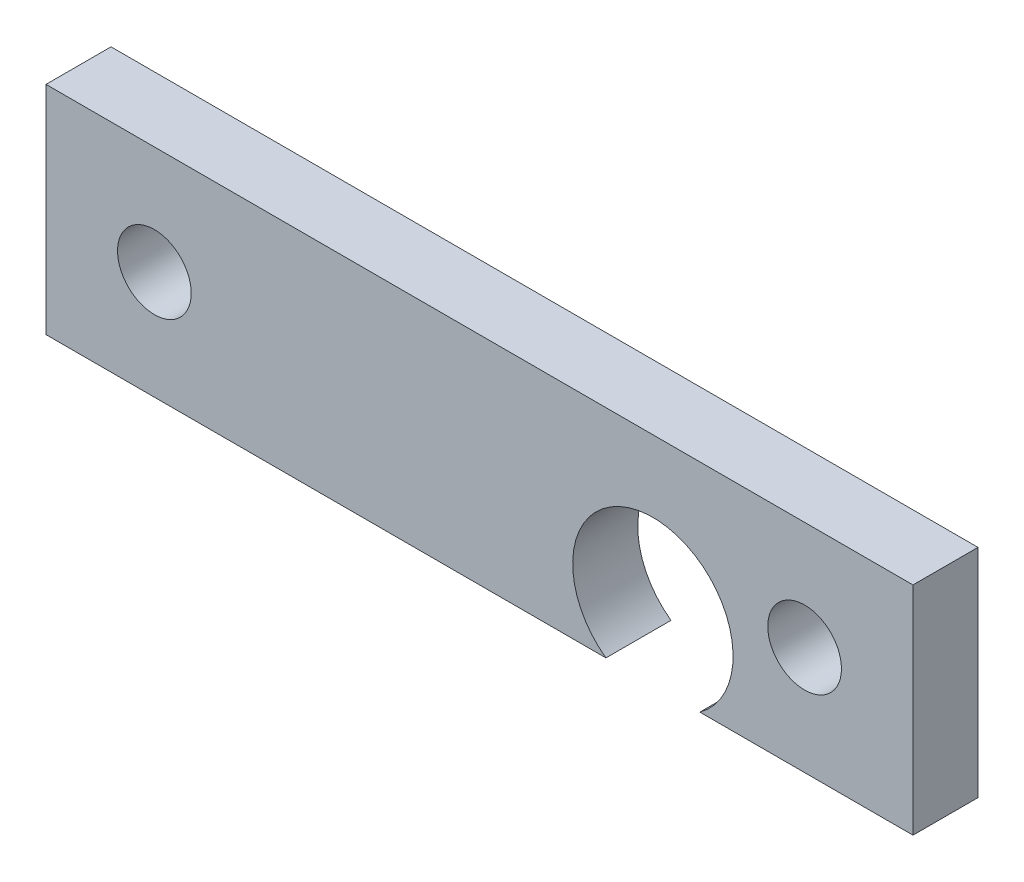
from build123d import *

# Parameters (mm, degrees)
MAIN_PROFILE_SKETCH_R = 1.7
MAIN_EXTRUSION_DEPTH  = 3


with BuildPart() as part:
    # Main Profile Sketch → Main Extrusion (new body)
    with BuildSketch(Plane.XY.offset(44.5)):
        with BuildLine():
            Line((-130, 41.5), (-90, 41.5))
            Line((-90, 41.5), (-90, 31.5))
            Line((-90, 31.5), (-99.834359217, 31.5))
            ThreePointArc((-99.834359217, 31.5), (-102, 38.2), (-104.165640783, 31.5))
            Line((-104.165640783, 31.5), (-130, 31.5))
            Line((-130, 31.5), (-130, 41.5))
        make_face()
        with Locations((-125, 36.5)):
            Circle(MAIN_PROFILE_SKETCH_R, mode=Mode.SUBTRACT)
        with Locations((-95, 36.5)):
            Circle(MAIN_PROFILE_SKETCH_R, mode=Mode.SUBTRACT)
    extrude(amount=-MAIN_EXTRUSION_DEPTH)


solid = part.part
